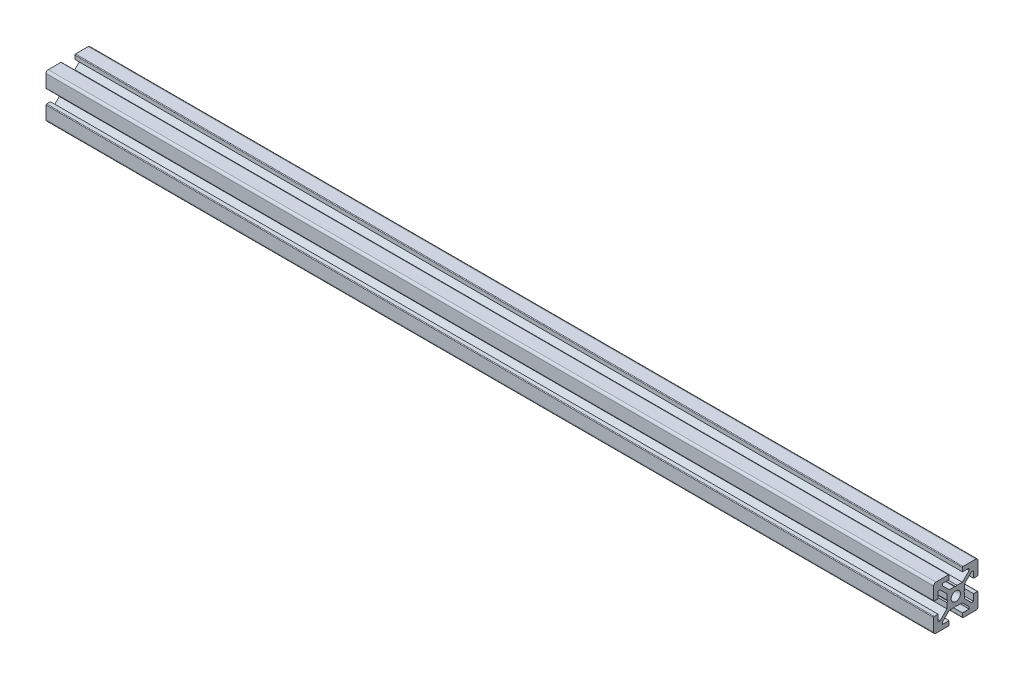
from build123d import *

# Parameters (mm, degrees)
SKETCH1_R           = 2.1
BOSS_EXTRUDE1_DEPTH = 400


with BuildPart() as part:
    # Sketch1 → Boss-Extrude1 (new body)
    with BuildSketch(Plane(origin=(0, 0, 0), x_dir=(0, 0, -1), z_dir=(1, 0, 0))):
        with BuildLine():
            Line((-9.935097613, 3.380939919), (-9.935097613, 9.080939919))
            ThreePointArc((-9.935097613, 9.080939919), (-9.642204394, 9.788046701), (-8.935097613, 10.080939919))
            Line((-8.935097613, 10.080939919), (-3.235097613, 10.080939919))
            ThreePointArc((-3.235097613, 10.080939919), (-3.022965579, 9.993071954), (-2.935097613, 9.780939919))
            Line((-2.935097613, 9.780939919), (-2.935097613, 8.080900091))
            Line((-2.935097613, 8.080900091), (-5.935097613, 8.080900091))
            Line((-5.935097613, 8.080900091), (-5.935097613, 7.141600091))
            Line((-5.935097613, 7.141600091), (-2.874424271, 4.080926749))
            Line((-2.874424271, 4.080926749), (-0.454699685, 4.080926749))
            Line((-0.454699685, 4.080926749), (0.064915557, 3.780926749))
            Line((0.064915557, 3.780926749), (0.5845308, 4.080926749))
            Line((0.5845308, 4.080926749), (3.004255385, 4.080926749))
            Line((3.004255385, 4.080926749), (6.064928728, 7.141600091))
            Line((6.064928728, 7.141600091), (6.064928728, 8.080900091))
            Line((6.064928728, 8.080900091), (3.064928728, 8.080900091))
            Line((3.064928728, 8.080900091), (3.064928728, 9.780939919))
            ThreePointArc((3.064928728, 9.780939919), (3.152796693, 9.993071954), (3.364928728, 10.080939919))
            Line((3.364928728, 10.080939919), (9.064928728, 10.080939919))
            ThreePointArc((9.064928728, 10.080939919), (9.772035509, 9.788046701), (10.064928728, 9.080939919))
            Line((10.064928728, 9.080939919), (10.064928728, 3.380939919))
            ThreePointArc((10.064928728, 3.380939919), (9.977060762, 3.168807885), (9.764928728, 3.080939919))
            Line((9.764928728, 3.080939919), (8.064888899, 3.080939919))
            Line((8.064888899, 3.080939919), (8.064888899, 6.080939919))
            Line((8.064888899, 6.080939919), (7.125588899, 6.080939919))
            Line((7.125588899, 6.080939919), (4.064915557, 3.020266577))
            Line((4.064915557, 3.020266577), (4.064915557, 0.600541991))
            Line((4.064915557, 0.600541991), (3.764915557, 0.080926749))
            Line((3.764915557, 0.080926749), (4.064915557, -0.438688493))
            Line((4.064915557, -0.438688493), (4.064915557, -2.858413079))
            Line((4.064915557, -2.858413079), (7.125588899, -5.919086421))
            Line((7.125588899, -5.919086421), (8.064888899, -5.919086421))
            Line((8.064888899, -5.919086421), (8.064888899, -2.919086421))
            Line((8.064888899, -2.919086421), (9.764928728, -2.919086421))
            ThreePointArc((9.764928728, -2.919086421), (9.977060762, -3.006954387), (10.064928728, -3.219086421))
            Line((10.064928728, -3.219086421), (10.064928728, -8.919086421))
            ThreePointArc((10.064928728, -8.919086421), (9.772035509, -9.626193203), (9.064928728, -9.919086421))
            Line((9.064928728, -9.919086421), (3.364928728, -9.919086421))
            ThreePointArc((3.364928728, -9.919086421), (3.152796693, -9.831218456), (3.064928728, -9.619086421))
            Line((3.064928728, -9.619086421), (3.064928728, -7.919046593))
            Line((3.064928728, -7.919046593), (6.064928728, -7.919046593))
            Line((6.064928728, -7.919046593), (6.064928728, -6.979746593))
            Line((6.064928728, -6.979746593), (3.004255385, -3.919073251))
            Line((3.004255385, -3.919073251), (0.5845308, -3.919073251))
            Line((0.5845308, -3.919073251), (0.064915557, -3.619073251))
            Line((0.064915557, -3.619073251), (-0.454699685, -3.919073251))
            Line((-0.454699685, -3.919073251), (-2.874424271, -3.919073251))
            Line((-2.874424271, -3.919073251), (-5.935097613, -6.979746593))
            Line((-5.935097613, -6.979746593), (-5.935097613, -7.919046593))
            Line((-5.935097613, -7.919046593), (-2.935097613, -7.919046593))
            Line((-2.935097613, -7.919046593), (-2.935097613, -9.619086421))
            ThreePointArc((-2.935097613, -9.619086421), (-3.022965579, -9.831218456), (-3.235097613, -9.919086421))
            Line((-3.235097613, -9.919086421), (-8.935097613, -9.919086421))
            ThreePointArc((-8.935097613, -9.919086421), (-9.642204394, -9.626193203), (-9.935097613, -8.919086421))
            Line((-9.935097613, -8.919086421), (-9.935097613, -3.219086421))
            ThreePointArc((-9.935097613, -3.219086421), (-9.847229647, -3.006954387), (-9.635097613, -2.919086421))
            Line((-9.635097613, -2.919086421), (-7.935057785, -2.919086421))
            Line((-7.935057785, -2.919086421), (-7.935057785, -5.919086421))
            Line((-7.935057785, -5.919086421), (-6.995757785, -5.919086421))
            Line((-6.995757785, -5.919086421), (-3.935084443, -2.858413079))
            Line((-3.935084443, -2.858413079), (-3.935084443, -0.438688493))
            Line((-3.935084443, -0.438688493), (-3.635084443, 0.080926749))
            Line((-3.635084443, 0.080926749), (-3.935084443, 0.600541991))
            Line((-3.935084443, 0.600541991), (-3.935084443, 3.020266577))
            Line((-3.935084443, 3.020266577), (-6.995757785, 6.080939919))
            Line((-6.995757785, 6.080939919), (-7.935057785, 6.080939919))
            Line((-7.935057785, 6.080939919), (-7.935057785, 3.080939919))
            Line((-7.935057785, 3.080939919), (-9.635097613, 3.080939919))
            ThreePointArc((-9.635097613, 3.080939919), (-9.847229647, 3.168807885), (-9.935097613, 3.380939919))
        make_face()
        with Locations((0.064915557, 0.080926749)):
            Circle(SKETCH1_R, mode=Mode.SUBTRACT)
    extrude(amount=BOSS_EXTRUDE1_DEPTH)


solid = part.part
